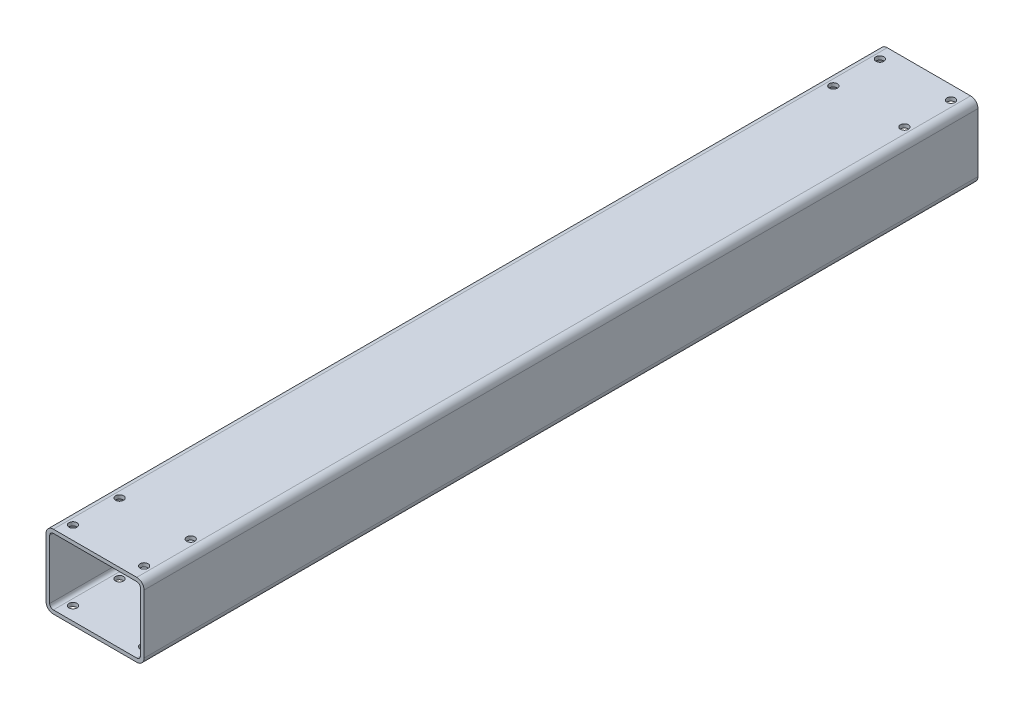
from build123d import *

# Parameters (mm, degrees)
BOSS_EXTRUDE1_DEPTH = 680
HOLE1_D             = 6.5


with BuildPart() as part:
    # Sketch1 → Boss-Extrude1 (new body)
    with BuildSketch(Plane.XY):
        with BuildLine():
            Line((-40, -24), (-40, 24))
            ThreePointArc((-40, 24), (-38.242640687, 28.242640687), (-34, 30))
            Line((-34, 30), (34, 30))
            ThreePointArc((34, 30), (38.242640687, 28.242640687), (40, 24))
            Line((40, 24), (40, -24))
            ThreePointArc((40, -24), (38.242640687, -28.242640687), (34, -30))
            Line((34, -30), (-34, -30))
            ThreePointArc((-34, -30), (-38.242640687, -28.242640687), (-40, -24))
        make_face()
        with BuildLine():
            Line((-34, 27), (34, 27))
            ThreePointArc((34, 27), (36.121320344, 26.121320344), (37, 24))
            Line((37, 24), (37, -24))
            ThreePointArc((37, -24), (36.121320344, -26.121320344), (34, -27))
            Line((34, -27), (-34, -27))
            ThreePointArc((-34, -27), (-36.121320344, -26.121320344), (-37, -24))
            Line((-37, -24), (-37, 24))
            ThreePointArc((-37, 24), (-36.121320344, 26.121320344), (-34, 27))
        make_face(mode=Mode.SUBTRACT)
    extrude(amount=BOSS_EXTRUDE1_DEPTH)

    # Hole1 (through all)
    with Locations(Plane(origin=(-29, 30, 669), x_dir=(1, 0, 0), z_dir=(0, 1, 0))):
        with Locations((0, 0), (0, 38), (58, 38), (58, 0), (0, 658), (0, 620), (58, 658), (58, 620)):
            Hole(HOLE1_D / 2)


solid = part.part
